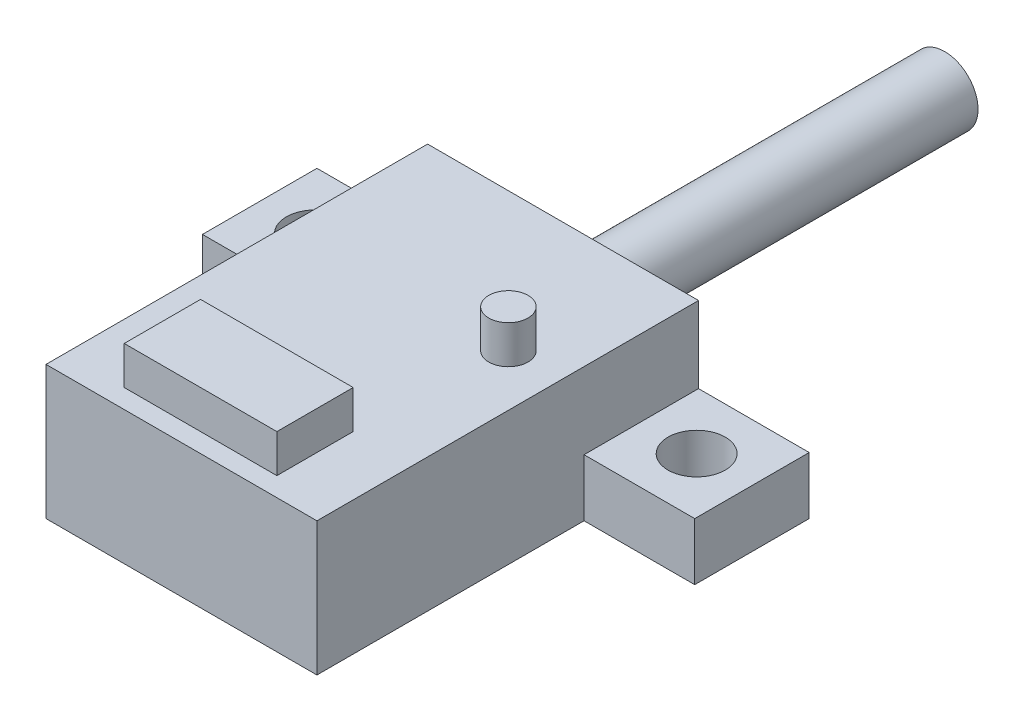
from build123d import *

# Parameters (mm, degrees)
EXTRUDE_1_DEPTH = 7
SKETCH_1_3_W    = 5.8
SKETCH_1_3_H    = 6
SKETCH_1_3_R    = 1.5
EXTRUDE_2_DEPTH = 3
SKETCH_2_W      = 8
SKETCH_2_H      = 4
EXTRUDE_3_DEPTH = 2
SKETCH_3_R      = 1.028764089
EXTRUDE_4_DEPTH = 2
SKETCH_4_R      = 1.75
EXTRUDE_5_DEPTH = 20


with BuildPart() as part:
    # 草图1 → 凸台-拉伸1 (new body)
    with BuildSketch(Plane(origin=(0, 0, 0), x_dir=(1, 0, 0), z_dir=(0, 1, 0))):
        Polygon((7.1, 10), (-7.1, 10), (-7.1, 4), (-7.1, -10), (7.1, -10), (7.1, 4), align=None)
    extrude(amount=EXTRUDE_1_DEPTH)

    # 草图1<3> → 凸台-拉伸2 (add)
    # profile 1 of 2: a face of its own
    with BuildSketch(Plane(origin=(0, 0, 0), x_dir=(1, 0, 0), z_dir=(0, 1, 0))):
        with Locations((-10, 7)):
            Rectangle(SKETCH_1_3_W, SKETCH_1_3_H)
        with Locations((-10, 7)):
            Circle(SKETCH_1_3_R, mode=Mode.SUBTRACT)
    # profile 2 of 2: a face of its own
    with BuildSketch(Plane(origin=(0, 0, 0), x_dir=(1, 0, 0), z_dir=(0, 1, 0))):
        with Locations((10, 7)):
            Rectangle(SKETCH_1_3_W, SKETCH_1_3_H)
        with Locations((10, 7)):
            Circle(SKETCH_1_3_R, mode=Mode.SUBTRACT)
    extrude(amount=EXTRUDE_2_DEPTH)

    # 草图2 → 凸台-拉伸3 (add)
    with BuildSketch(Plane(origin=(0, 7, 0), x_dir=(1, 0, 0), z_dir=(0, 1, 0))):
        with Locations((0, -7)):
            Rectangle(SKETCH_2_W, SKETCH_2_H)
    extrude(amount=EXTRUDE_3_DEPTH)

    # 草图3 → 凸台-拉伸4 (add)
    with BuildSketch(Plane(origin=(0, 7, 0), x_dir=(1, 0, 0), z_dir=(0, 1, 0))):
        with Locations((4.398397856, 2.736092563)):
            Circle(SKETCH_3_R)
    extrude(amount=EXTRUDE_4_DEPTH)

    # 草图4 → 凸台-拉伸5 (add)
    with BuildSketch(Plane(origin=(0, 0, -10), x_dir=(-1, 0, 0), z_dir=(0, 0, -1))):
        with Locations((0, 3)):
            Circle(SKETCH_4_R)
    extrude(amount=EXTRUDE_5_DEPTH)


solid = part.part
